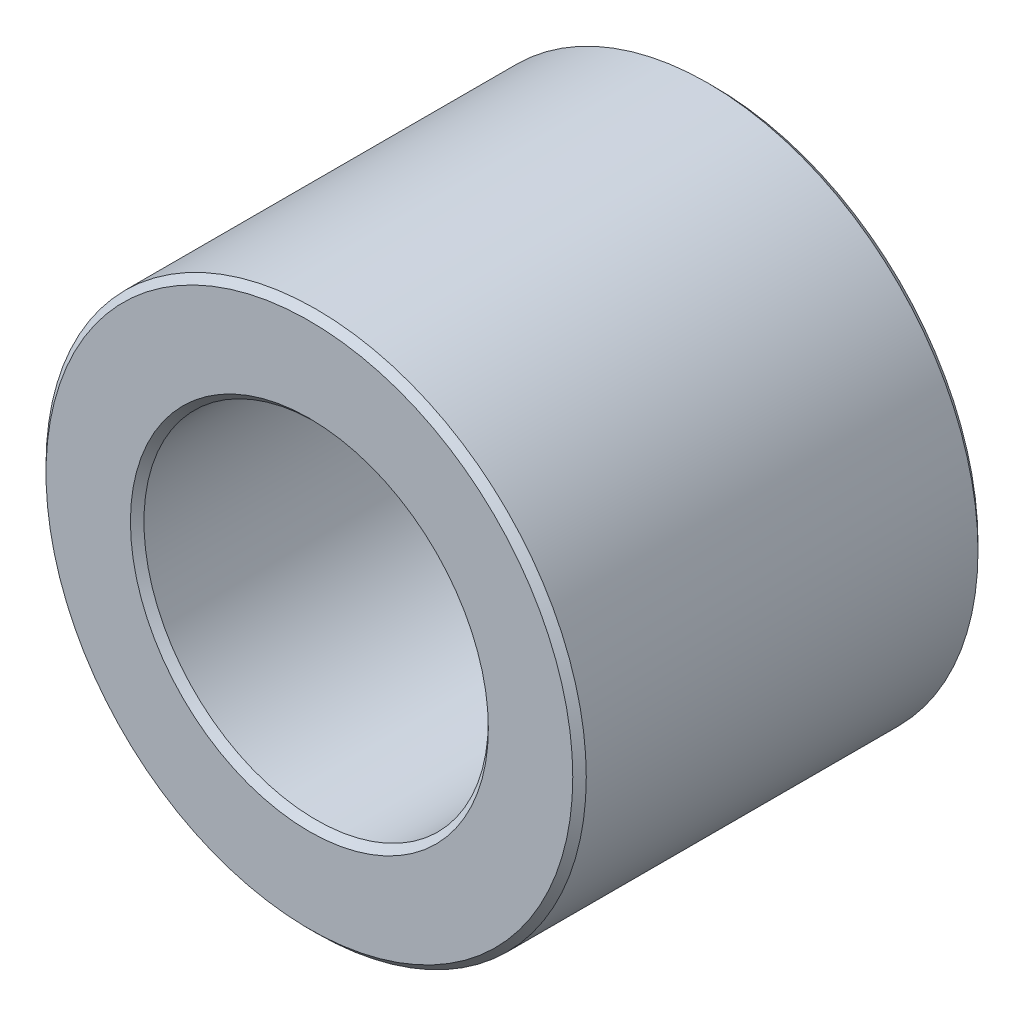
from build123d import *

# Parameters (mm, degrees)
ESBO_O1_R                = 4
ESBO_O1_R_2              = 2.55
RESSALTO_EXTRUS_O1_DEPTH = 6
CHANFRO1_SIZE            = 0.1


with BuildPart() as part:
    # Esboço1 → Ressalto-extrusão1 (new body)
    with BuildSketch(Plane.XY):
        Circle(ESBO_O1_R)
        Circle(ESBO_O1_R_2, mode=Mode.SUBTRACT)
    extrude(amount=RESSALTO_EXTRUS_O1_DEPTH)

    # Chanfro1
    chanfro1_edges = [part.edges().sort_by_distance(p)[0] for p in [
        (-4, 0, 0),
        (-4, 0, 6),
        (-2.55, 0, 0),
        (-2.55, 0, 6),
    ]]
    chamfer(chanfro1_edges, length=CHANFRO1_SIZE)


solid = part.part
